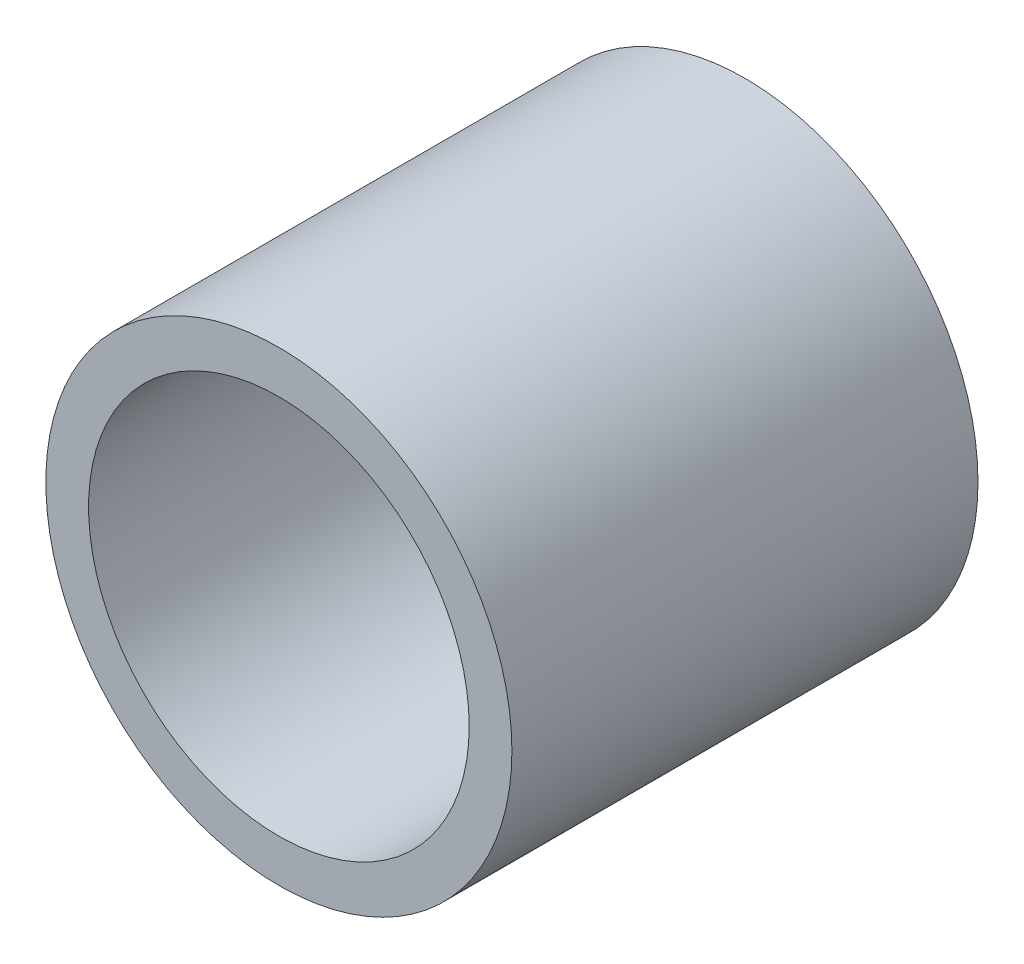
from build123d import *

# Parameters (mm, degrees)
SKETCH1_R           = 60
BOSS_EXTRUDE1_DEPTH = 120
SKETCH2_R           = 49
CUT_EXTRUDE1_DEPTH  = 130


with BuildPart() as part:
    # Sketch1 → Boss-Extrude1 (new body)
    with BuildSketch(Plane.XY):
        Circle(SKETCH1_R)
    extrude(amount=BOSS_EXTRUDE1_DEPTH)

    # Sketch2 → Cut-Extrude1 (cut)
    with BuildSketch(Plane.XY.offset(120)):
        Circle(SKETCH2_R)
    extrude(amount=-CUT_EXTRUDE1_DEPTH, mode=Mode.SUBTRACT)


solid = part.part
